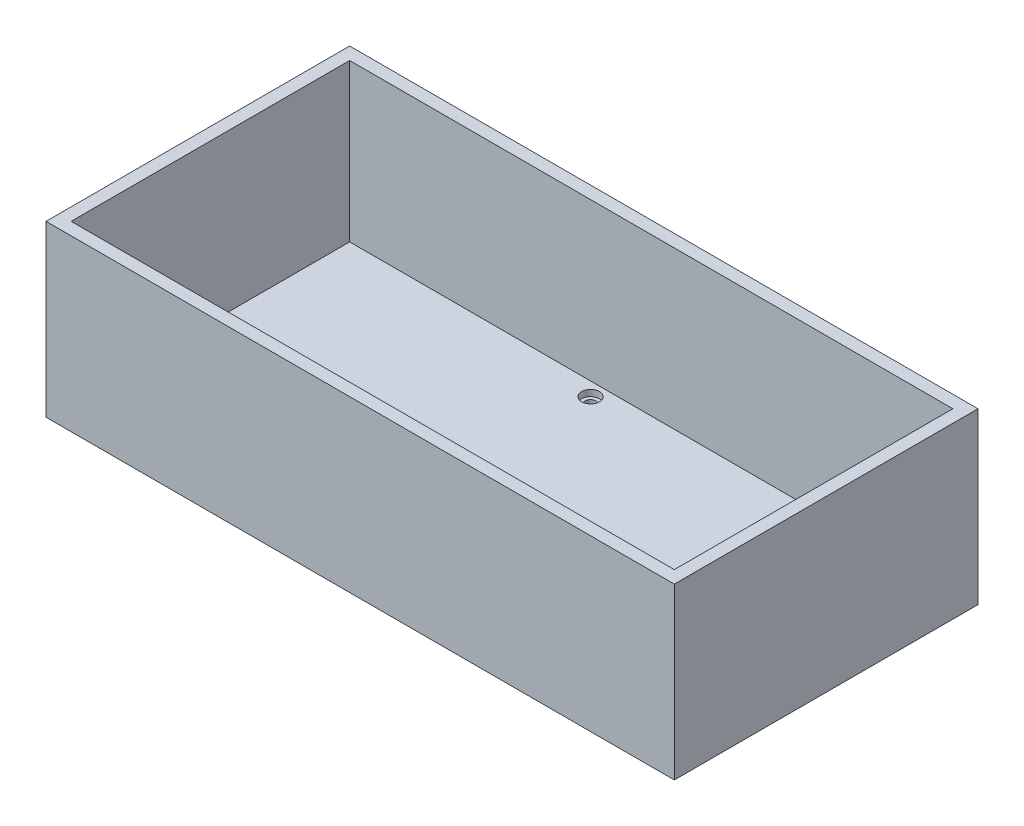
from build123d import *

# Parameters (mm, degrees)
SKETCH_1_W          = 300
SKETCH_1_H          = 145
EXTRUDE_1_DEPTH     = 81
SHELL_1_T           = -6
SKETCH_2_R          = 2.55
CUT_EXTRUDE_1_DEPTH = 183.705363906
SKETCH_3_R          = 4.25
CUT_EXTRUDE_2_DEPTH = 3


with BuildPart() as part:
    # ｽｹｯﾁ1 → ﾎﾞｽ - 押し出し1 (new body)
    with BuildSketch(Plane(origin=(0, 0, 0), x_dir=(1, 0, 0), z_dir=(0, 1, 0))):
        Rectangle(SKETCH_1_W, SKETCH_1_H)
    extrude(amount=EXTRUDE_1_DEPTH)

    # ｼｪﾙ1
    shell_1_openings = [part.faces().sort_by_distance(p)[0] for p in [
        (0, 81, 0),
    ]]
    offset(amount=SHELL_1_T, openings=shell_1_openings, kind=Kind.INTERSECTION)

    # ｽｹｯﾁ2 → ｶｯﾄ - 押し出し1 (cut, through all)
    with BuildSketch(Plane(origin=(0, 6, 0), x_dir=(1, 0, 0), z_dir=(0, 1, 0))):
        with Locations(Location((140, 60, 0), (0, 0, 270))):
            Circle(SKETCH_2_R)
        with Locations(Location((140, -60, 0), (0, 0, 90))):
            Circle(SKETCH_2_R)
        with Locations(Location((-22.5, -60, 0), (0, 0, 270))):
            Circle(SKETCH_2_R)
        with Locations(Location((-22.5, 60, 0), (0, 0, 90))):
            Circle(SKETCH_2_R)
    extrude(amount=-CUT_EXTRUDE_1_DEPTH, mode=Mode.SUBTRACT)

    # ｽｹｯﾁ3 → ｶｯﾄ - 押し出し2 (cut)
    with BuildSketch(Plane(origin=(0, 6, 0), x_dir=(1, 0, 0), z_dir=(0, 1, 0))):
        with Locations(Location((140, 60, 0), (0, 0, 270))):
            Circle(SKETCH_3_R)
        with Locations(Location((-22.5, 60, 0), (0, 0, 270))):
            Circle(SKETCH_3_R)
        with Locations(Location((-22.5, -60, 0), (0, 0, 270))):
            Circle(SKETCH_3_R)
        with Locations(Location((140, -60, 0), (0, 0, 270))):
            Circle(SKETCH_3_R)
    extrude(amount=-CUT_EXTRUDE_2_DEPTH, mode=Mode.SUBTRACT)


solid = part.part
